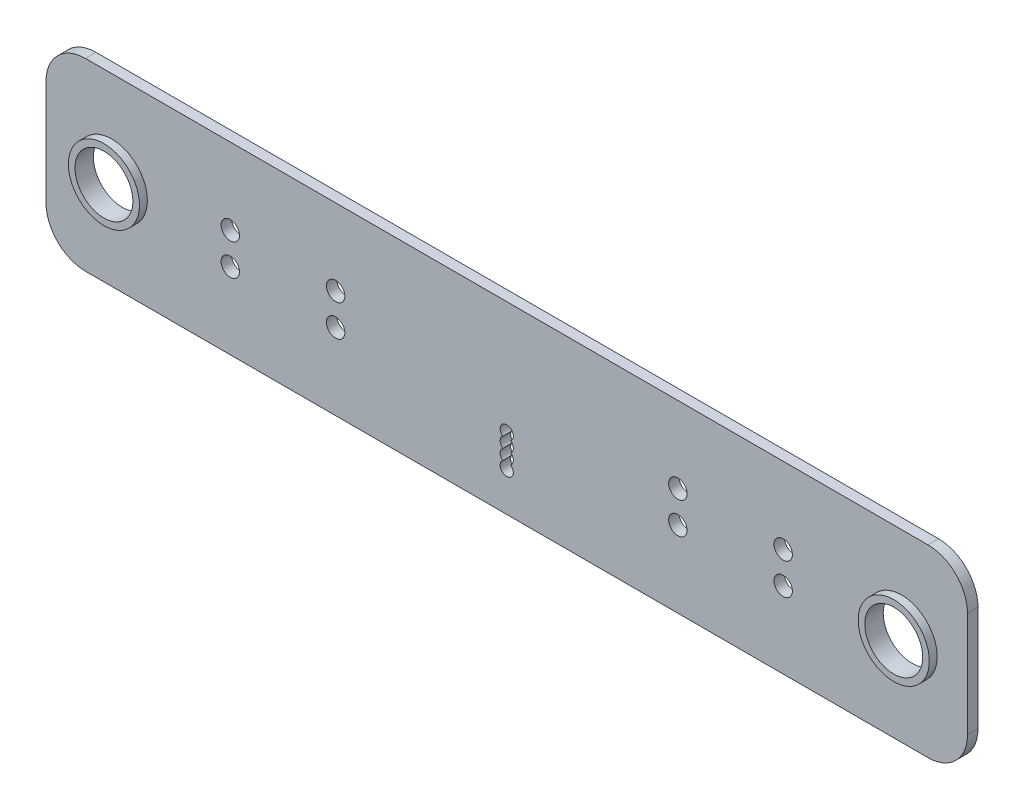
from build123d import *

# Parameters (mm, degrees)
SKETCH1_W           = 350
SKETCH1_H           = 70
BOSS_EXTRUDE1_DEPTH = 4
FILLET1_R           = 15
SKETCH2_R           = 11
CUT_EXTRUDE1_DEPTH  = 10
SKETCH3_R           = 17.5
SKETCH3_R_2         = 15
BOSS_EXTRUDE2_DEPTH = 6
SKETCH4_R           = 3.5
CUT_EXTRUDE3_DEPTH  = 10
SKETCH5_W           = 350
SKETCH5_H           = 21.234643784
CUT_EXTRUDE4_DEPTH  = 142
SKETCH6_R           = 13.5
SKETCH6_R_2         = 11
BOSS_EXTRUDE3_DEPTH = 3


with BuildPart() as part:
    # Sketch1 → Boss-Extrude1 (new body)
    with BuildSketch(Plane.XY):
        Rectangle(SKETCH1_W, SKETCH1_H)
    extrude(amount=BOSS_EXTRUDE1_DEPTH)

    # Fillet1
    fillet1_edges = [part.edges().sort_by_distance(p)[0] for p in [
        (175, -35, 2),
        (-175, -35, 2),
        (-175, 35, 2),
        (175, 35, 2),
    ]]
    fillet(fillet1_edges, radius=FILLET1_R)

    # Sketch2 → Cut-Extrude1 (cut)
    with BuildSketch(Plane(origin=(0, 0, 0), x_dir=(-1, 0, 0), z_dir=(0, 0, -1))):
        with Locations((-150, 0)):
            Circle(SKETCH2_R)
    cut_extrude1 = extrude(amount=-CUT_EXTRUDE1_DEPTH, mode=Mode.SUBTRACT)

    # Sketch3 → Boss-Extrude2 (add)
    with BuildSketch(Plane(origin=(0, 0, 0), x_dir=(-1, 0, 0), z_dir=(0, 0, -1))):
        with Locations(Location((-150, 0, 0), (0, 0, 180))):
            Circle(SKETCH3_R)
        with Locations((-150, 0)):
            Circle(SKETCH3_R_2, mode=Mode.SUBTRACT)
    boss_extrude2 = extrude(amount=BOSS_EXTRUDE2_DEPTH)

    # Mirror2: Cut-Extrude1, Boss-Extrude2 across plane
    add(cut_extrude1.mirror(Plane(origin=(0, 0, 0), x_dir=(0, 0, 1), z_dir=(1, 0, 0))), mode=Mode.SUBTRACT)
    add(boss_extrude2.mirror(Plane(origin=(0, 0, 0), x_dir=(0, 0, 1), z_dir=(1, 0, 0))))

    # Sketch4 → Cut-Extrude3 (cut)
    with BuildSketch(Plane.XY.offset(4)):
        with Locations((-105, 6)):
            Circle(SKETCH4_R)
        with Locations((-105, -6)):
            Circle(SKETCH4_R)
        with Locations((-65, -6)):
            Circle(SKETCH4_R)
        with Locations((-65, 6)):
            Circle(SKETCH4_R)
        with Locations((65, 6)):
            Circle(SKETCH4_R)
        with Locations((65, -6)):
            Circle(SKETCH4_R)
        with Locations((105, -6)):
            Circle(SKETCH4_R)
        with Locations((105, 6)):
            Circle(SKETCH4_R)
        with BuildLine():
            ThreePointArc((-1.5, -14), (-2.5, -12), (-1.5, -10))
            ThreePointArc((-1.5, -10), (0, -5.5), (1.5, -10))
            ThreePointArc((1.5, -10), (2.5, -12), (1.5, -14))
            ThreePointArc((1.5, -14), (2.5, -16), (1.5, -18))
            ThreePointArc((1.5, -18), (0, -22.5), (-1.5, -18))
            ThreePointArc((-1.5, -18), (-2.5, -16), (-1.5, -14))
        make_face()
    extrude(amount=-CUT_EXTRUDE3_DEPTH, mode=Mode.SUBTRACT)

    # Sketch5 → Cut-Extrude4 (cut)
    with BuildSketch(Plane(origin=(0, 35, 0), x_dir=(1, 0, 0), z_dir=(0, 1, 0))):
        with Locations((0, 10.617321892)):
            Rectangle(SKETCH5_W, SKETCH5_H)
    extrude(amount=-CUT_EXTRUDE4_DEPTH, mode=Mode.SUBTRACT)

    # Sketch6 → Boss-Extrude3 (add)
    # profile 1 of 2: a face of its own
    with BuildSketch(Plane.XY.offset(4)):
        with Locations((-150, 0)):
            Circle(SKETCH6_R)
        with Locations((-150, 0)):
            Circle(SKETCH6_R_2, mode=Mode.SUBTRACT)
    # profile 2 of 2: a face of its own
    with BuildSketch(Plane.XY.offset(4)):
        with Locations((150, 0)):
            Circle(SKETCH6_R)
        with Locations(Location((150, 0, 0), (0, 0, 180))):
            Circle(SKETCH6_R_2, mode=Mode.SUBTRACT)
    extrude(amount=BOSS_EXTRUDE3_DEPTH)


solid = part.part
